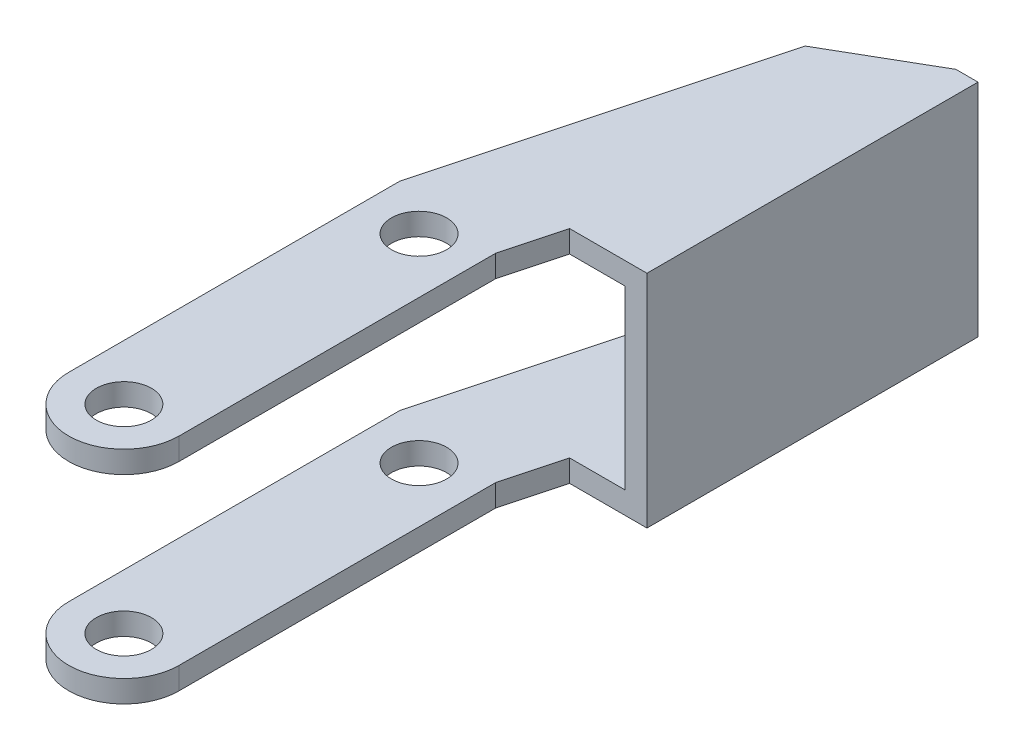
from build123d import *

# Parameters (mm, degrees)
SKETCH2_W           = 30
SKETCH2_H           = 20
BOSS_EXTRUDE1_DEPTH = 2
SKETCH3_R           = 2.5
BOSS_EXTRUDE2_DEPTH = 2


with BuildPart() as part:
    # Sketch2 → Boss-Extrude1 (new body)
    with BuildSketch(Plane.ZY.offset(20)):
        Rectangle(SKETCH2_W, SKETCH2_H)
    extrude(amount=BOSS_EXTRUDE1_DEPTH)

    # Sketch3 → Boss-Extrude2 (add)
    with BuildSketch(Plane(origin=(0, 10, 0), x_dir=(1, 0, 0), z_dir=(0, 1, 0))):
        with BuildLine():
            Line((-22, -15), (-22, 15))
            Line((-22, 15), (-30.660254038, 10))
            Line((-30.660254038, 10), (-38.424825391, -18.977774789))
            Line((-38.424825391, -18.977774789), (-38.424825391, -48.977774789))
            ThreePointArc((-38.424825391, -48.977774789), (-33.424825391, -53.977774789), (-28.424825391, -48.977774789))
            Line((-28.424825391, -48.977774789), (-28.424825391, -20.294299765))
            Line((-28.424825391, -20.294299765), (-27.006222045, -15))
            Line((-27.006222045, -15), (-22, -15))
        make_face()
        with Locations(Location((-33.424825391, -48.977774789, 0), (0, 0, 270))):
            Circle(SKETCH3_R, mode=Mode.SUBTRACT)
        with Locations(Location((-33.424825391, -22.229962666, 0), (0, 0, 270))):
            Circle(SKETCH3_R, mode=Mode.SUBTRACT)
    boss_extrude2 = extrude(amount=-BOSS_EXTRUDE2_DEPTH)

    # Mirror1: Boss-Extrude2 across plane
    add(boss_extrude2.mirror(Plane(origin=(0, 0, 0), x_dir=(0, 0, 1), z_dir=(0, -1, 0))))


solid = part.part
